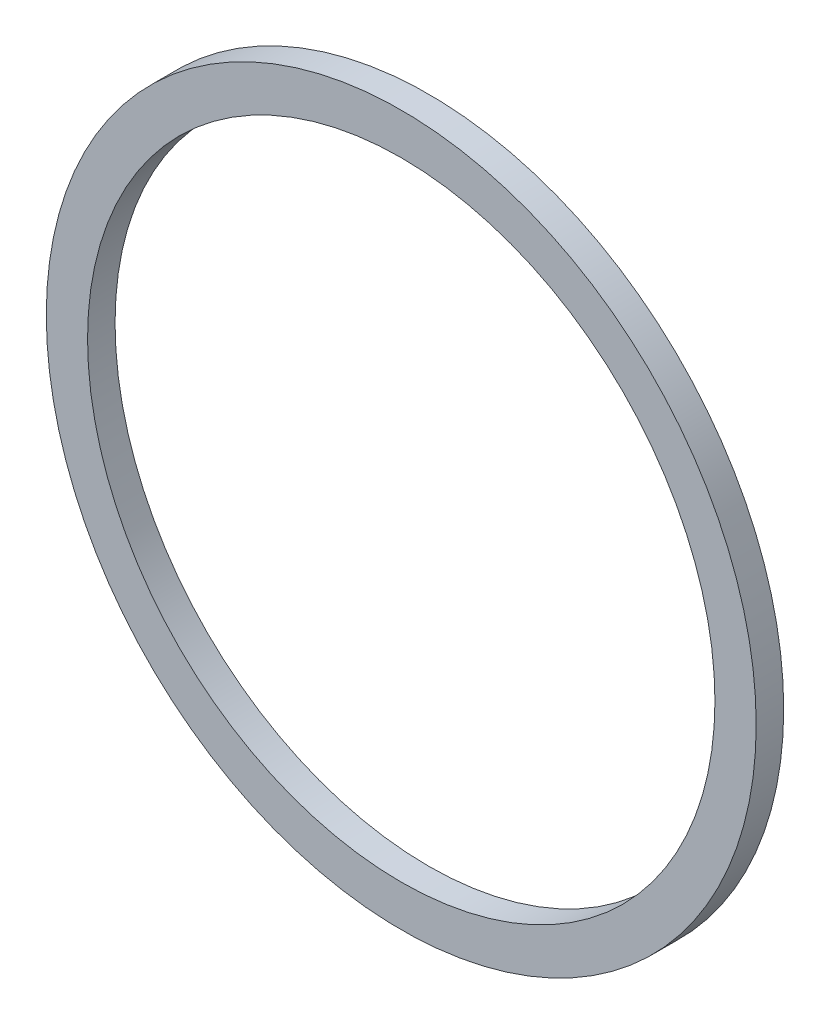
from build123d import *

# Parameters (mm, degrees)
SKETCH1_R           = 81.9404
SKETCH1_R_2         = 72.4154
BOSS_EXTRUDE1_DEPTH = 6.35


with BuildPart() as part:
    # Sketch1 → Boss-Extrude1 (new body)
    with BuildSketch(Plane.XY):
        with Locations((0, -76.2)):
            Circle(SKETCH1_R)
        with Locations((0, -76.2)):
            Circle(SKETCH1_R_2, mode=Mode.SUBTRACT)
    extrude(amount=BOSS_EXTRUDE1_DEPTH)


solid = part.part
